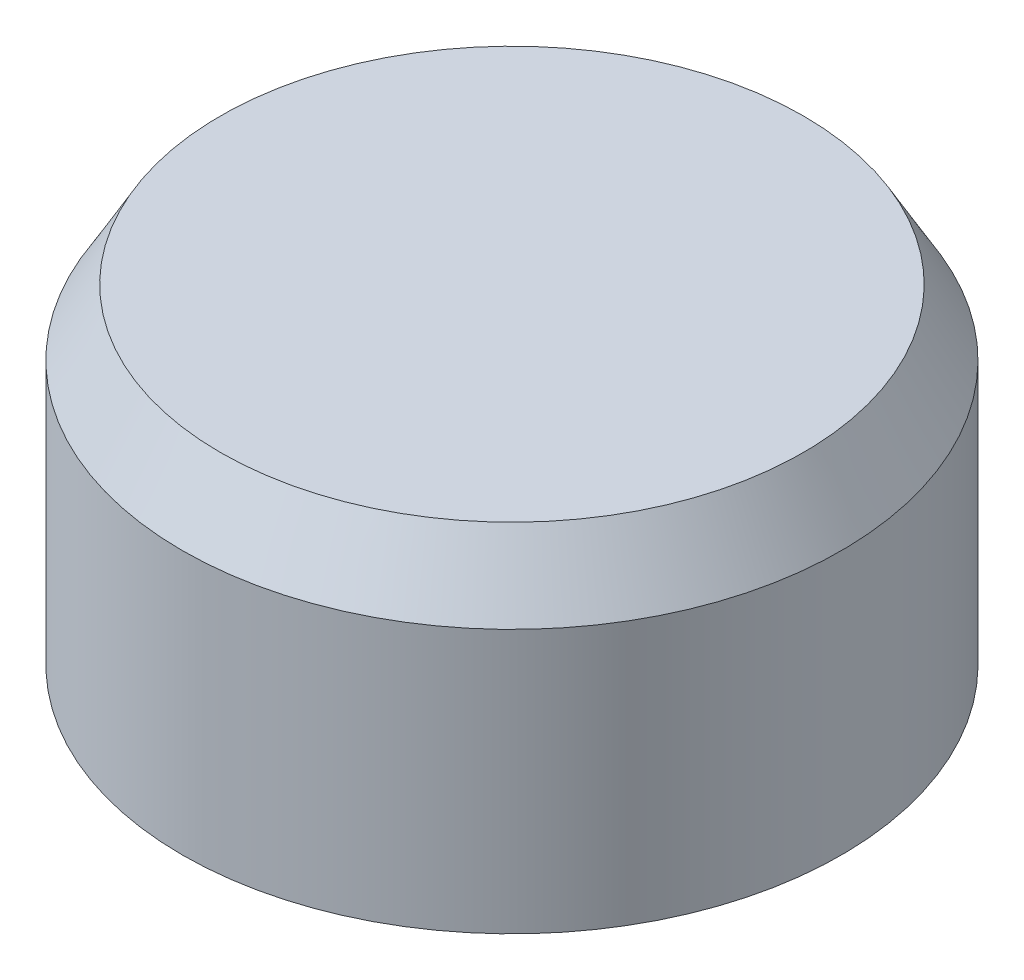
from build123d import *

# Parameters (mm, degrees)
SKETCH_148_R          = 10
EXTRUDE_195_DEPTH     = 10
CUT_EXTRUDE_296_DEPTH = 5
CHAMFER_1_SIZE        = 2
CHAMFER_1_SIZE2       = 1.154700538


with BuildPart() as part:
    # Sketch 148 → Extrude 195 (new body)
    with BuildSketch(Plane(origin=(0, 0, 0), x_dir=(1, 0, 0), z_dir=(0, 1, 0))):
        with Locations(Location((0, 0, 0), (0, 0, 270))):
            Circle(SKETCH_148_R)
    extrude(amount=EXTRUDE_195_DEPTH)

    # Sketch 234 → Cut-Extrude 296 (cut)
    with BuildSketch(Plane(origin=(0, 0, 0), x_dir=(1, 0, 0), z_dir=(0, 1, 0))):
        with BuildLine():
            Line((-2, -1.5), (2, -1.5))
            ThreePointArc((2, -1.5), (0, 2.5), (-2, -1.5))
        make_face()
    extrude(amount=CUT_EXTRUDE_296_DEPTH, mode=Mode.SUBTRACT)

    # Фаска1
    chamfer_1_edges = [part.edges().sort_by_distance(p)[0] for p in [
        (0, 10, -10),
    ]]
    chamfer_1_side = [part.faces().sort_by_distance(p)[0] for p in [
        (0, 5, -10),
    ]]
    chamfer(chamfer_1_edges, length=CHAMFER_1_SIZE, length2=CHAMFER_1_SIZE2, reference=chamfer_1_side[0])


solid = part.part
